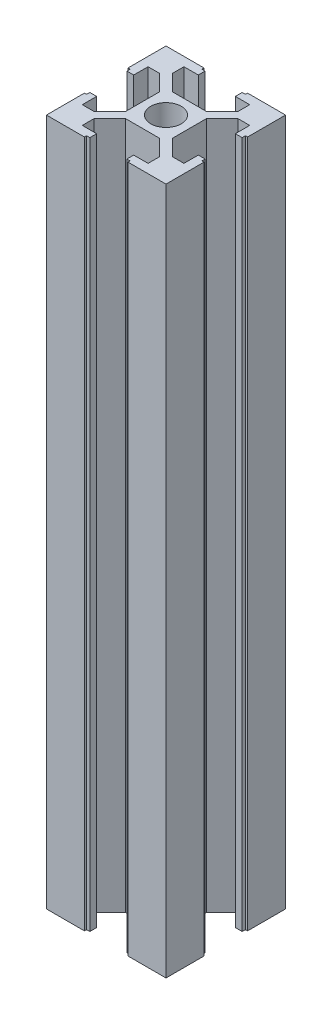
from build123d import *

# Parameters (mm, degrees)
SKETCH1_R           = 2.55
BOSS_EXTRUDE1_DEPTH = 57.5


with BuildPart() as part:
    # Sketch1 → Boss-Extrude1 (new, symmetric)
    with BuildSketch(Plane(origin=(0, 0, 0), x_dir=(1, 0, 0), z_dir=(0, 1, 0))):
        Polygon((-6.560660172, 5.5), (-3.9, 2.839339828), (-3.9, -2.839339828), (-6.560660172, -5.5), (-8.5, -5.5), (-8.5, -3.1), (-9.639683838, -3.1), (-9.639683838, -3.65), (-10, -3.65), (-10, -10), (-3.65, -10), (-3.65, -9.639683838), (-3.1, -9.639683838), (-3.1, -8.5), (-5.5, -8.5), (-5.5, -6.560660172), (-2.839339828, -3.9), (2.839339828, -3.9), (5.5, -6.560660172), (5.5, -8.5), (3.1, -8.5), (3.1, -9.639683838), (3.65, -9.639683838), (3.65, -10), (10, -10), (10, -3.65), (9.639683838, -3.65), (9.639683838, -3.1), (8.5, -3.1), (8.5, -5.5), (6.560660172, -5.5), (3.9, -2.839339828), (3.9, 2.839339828), (6.560660172, 5.5), (8.5, 5.5), (8.5, 3.1), (9.639683838, 3.1), (9.639683838, 3.65), (10, 3.65), (10, 10), (3.65, 10), (3.65, 9.639683838), (3.1, 9.639683838), (3.1, 8.5), (5.5, 8.5), (5.5, 6.560660172), (2.839339828, 3.9), (-2.839339828, 3.9), (-5.5, 6.560660172), (-5.5, 8.5), (-3.1, 8.5), (-3.1, 9.639683838), (-3.65, 9.639683838), (-3.65, 10), (-10, 10), (-10, 3.65), (-9.639683838, 3.65), (-9.639683838, 3.1), (-8.5, 3.1), (-8.5, 5.5), align=None)
        with Locations(Location((0, 0, 0), (0, 0, 270))):
            Circle(SKETCH1_R, mode=Mode.SUBTRACT)
    extrude(amount=BOSS_EXTRUDE1_DEPTH, both=True)


solid = part.part
